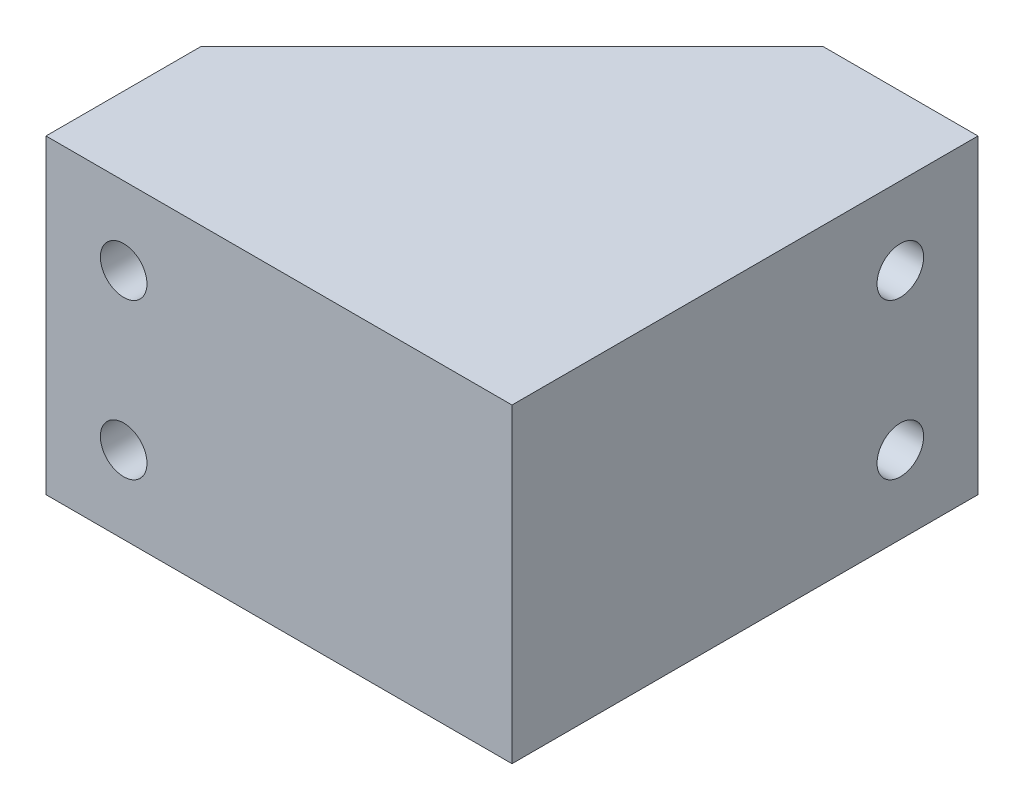
from build123d import *

# Parameters (mm, degrees)
BOSS_EXTRUDE1_DEPTH = 6.35
SKETCH2_R           = 0.9525
CUT_EXTRUDE1_DEPTH  = 23.455171572
SKETCH3_R           = 0.9525
CUT_EXTRUDE2_DEPTH  = 23.234798889


with BuildPart() as part:
    # Sketch1 → Boss-Extrude1 (new, symmetric)
    with BuildSketch(Plane(origin=(0, 0, 0), x_dir=(1, 0, 0), z_dir=(0, 1, 0))):
        Polygon((-9.547841727, -2.649640288), (3.152158273, 10.050359712), (9.502158273, 10.050359712), (9.502158273, -8.999640288), (-9.547841727, -8.999640288), align=None)
    extrude(amount=BOSS_EXTRUDE1_DEPTH, both=True)

    # Sketch2 → Cut-Extrude1 (cut, through all)
    with BuildSketch(Plane(origin=(9.502158273, 0, 0), x_dir=(0, 0, -1), z_dir=(1, 0, 0))):
        with Locations((6.875359712, 3.175)):
            Circle(SKETCH2_R)
        with Locations((6.875359712, -3.175)):
            Circle(SKETCH2_R)
    extrude(amount=-CUT_EXTRUDE1_DEPTH, mode=Mode.SUBTRACT)

    # Sketch3 → Cut-Extrude2 (cut, through all)
    with BuildSketch(Plane.XY.offset(8.999640288)):
        with Locations((-6.372841727, 3.175)):
            Circle(SKETCH3_R)
        with Locations((-6.372841727, -3.175)):
            Circle(SKETCH3_R)
    extrude(amount=-CUT_EXTRUDE2_DEPTH, mode=Mode.SUBTRACT)


solid = part.part
